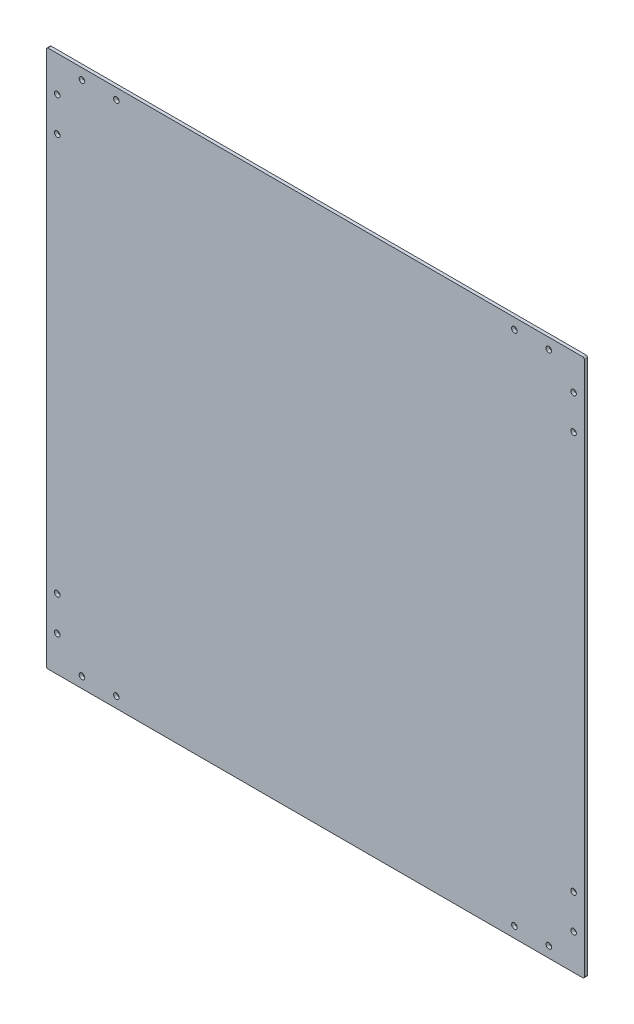
from build123d import *

# Parameters (mm, degrees)
SKETCH1_W           = 500
SKETCH1_H           = 500
SKETCH1_R           = 2.6
BOSS_EXTRUDE1_DEPTH = 3
FILLET1_R           = 1.5


with BuildPart() as part:
    # Sketch1 → Boss-Extrude1 (new body)
    with BuildSketch(Plane.XY):
        with Locations((0, -240)):
            Rectangle(SKETCH1_W, SKETCH1_H)
        with Locations((-185, 0)):
            Circle(SKETCH1_R, mode=Mode.SUBTRACT)
        with Locations((-217, 0)):
            Circle(SKETCH1_R, mode=Mode.SUBTRACT)
        with Locations((-240, -23)):
            Circle(SKETCH1_R, mode=Mode.SUBTRACT)
        with Locations((-240, -55)):
            Circle(SKETCH1_R, mode=Mode.SUBTRACT)
        with Locations(Location((-240, -425, 0), (0, 0, 180))):
            Circle(SKETCH1_R, mode=Mode.SUBTRACT)
        with Locations(Location((-240, -457, 0), (0, 0, 180))):
            Circle(SKETCH1_R, mode=Mode.SUBTRACT)
        with Locations(Location((-217, -480, 0), (0, 0, 180))):
            Circle(SKETCH1_R, mode=Mode.SUBTRACT)
        with Locations(Location((-185, -480, 0), (0, 0, 180))):
            Circle(SKETCH1_R, mode=Mode.SUBTRACT)
        with Locations((185, -480)):
            Circle(SKETCH1_R, mode=Mode.SUBTRACT)
        with Locations((217, -480)):
            Circle(SKETCH1_R, mode=Mode.SUBTRACT)
        with Locations((240, -457)):
            Circle(SKETCH1_R, mode=Mode.SUBTRACT)
        with Locations((240, -425)):
            Circle(SKETCH1_R, mode=Mode.SUBTRACT)
        with Locations(Location((240, -55, 0), (0, 0, 180))):
            Circle(SKETCH1_R, mode=Mode.SUBTRACT)
        with Locations(Location((240, -23, 0), (0, 0, 180))):
            Circle(SKETCH1_R, mode=Mode.SUBTRACT)
        with Locations(Location((217, 0, 0), (0, 0, 180))):
            Circle(SKETCH1_R, mode=Mode.SUBTRACT)
        with Locations(Location((185, 0, 0), (0, 0, 180))):
            Circle(SKETCH1_R, mode=Mode.SUBTRACT)
    extrude(amount=BOSS_EXTRUDE1_DEPTH)

    # Fillet1
    fillet1_edges = [part.edges().sort_by_distance(p)[0] for p in [
        (-250, 10, 1.5),
        (250, 10, 1.5),
        (250, -490, 1.5),
        (-250, -490, 1.5),
    ]]
    fillet(fillet1_edges, radius=FILLET1_R)


solid = part.part
